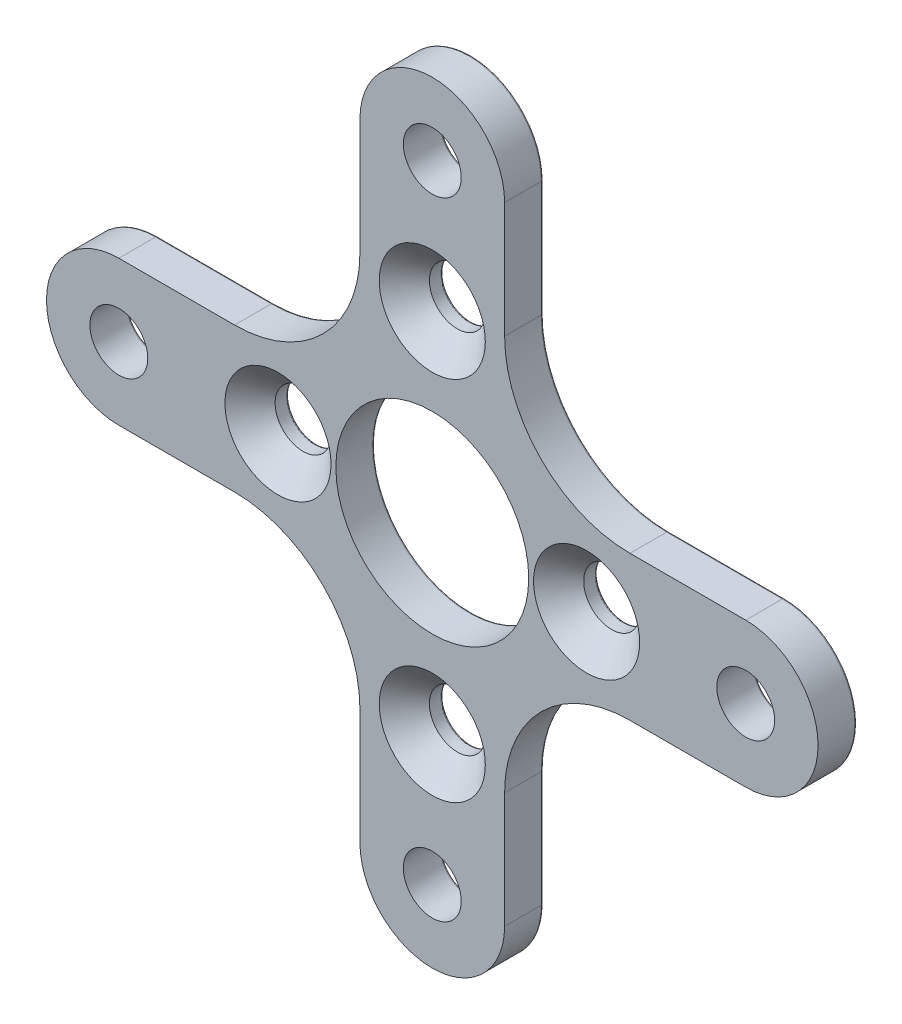
from build123d import *

# Parameters (mm, degrees)
ESQUISSE1_R                                  = 5
ESQUISSE1_R_2                                = 1.5
BOSS_EXTRU_1_DEPTH                           = 1
FRAISAGE_POUR_VIS_T_TE_FRAIS_E_M2_51_A_COUNT = 2
FRAISAGE_POUR_VIS_T_TE_FRAIS_E_M2_51_A_PITCH = 12.419742348
FRAISAGE_POUR_VIS_T_TE_FRAIS_E_M2_2_COUNT    = 2
FRAISAGE_POUR_VIS_T_TE_FRAIS_E_M2_2_PITCH    = 16
FRAISAGE_POUR_VIS_T_TE_FRAIS_E_M2_3_COUNT    = 2
FRAISAGE_POUR_VIS_T_TE_FRAIS_E_M2_3_PITCH    = 12.419742348
CONG_1_R                                     = 0.1


with BuildPart() as part:
    # Esquisse1 → Boss.-Extru.1 (new, symmetric)
    with BuildSketch(Plane.XY):
        with BuildLine():
            Line((-3.75, 16.25), (-3.75, 10.25))
            ThreePointArc((-3.75, 10.25), (-5.653805922, 5.653805922), (-10.25, 3.75))
            Line((-10.25, 3.75), (-16.25, 3.75))
            ThreePointArc((-16.25, 3.75), (-20, 0), (-16.25, -3.75))
            Line((-16.25, -3.75), (-10.25, -3.75))
            ThreePointArc((-10.25, -3.75), (-5.653805922, -5.653805922), (-3.75, -10.25))
            Line((-3.75, -10.25), (-3.75, -16.25))
            ThreePointArc((-3.75, -16.25), (0, -20), (3.75, -16.25))
            Line((3.75, -16.25), (3.75, -10.25))
            ThreePointArc((3.75, -10.25), (5.653805922, -5.653805922), (10.25, -3.75))
            Line((10.25, -3.75), (16.25, -3.75))
            ThreePointArc((16.25, -3.75), (20, 0), (16.25, 3.75))
            Line((16.25, 3.75), (10.25, 3.75))
            ThreePointArc((10.25, 3.75), (5.653805922, 5.653805922), (3.75, 10.25))
            Line((3.75, 10.25), (3.75, 16.25))
            ThreePointArc((3.75, 16.25), (0, 20), (-3.75, 16.25))
        make_face()
        Circle(ESQUISSE1_R, mode=Mode.SUBTRACT)
        with Locations((0, 16.25)):
            Circle(ESQUISSE1_R_2, mode=Mode.SUBTRACT)
        with Locations((16.25, 0)):
            Circle(ESQUISSE1_R_2, mode=Mode.SUBTRACT)
        with Locations((-16.25, 0)):
            Circle(ESQUISSE1_R_2, mode=Mode.SUBTRACT)
        with Locations((0, -16.25)):
            Circle(ESQUISSE1_R_2, mode=Mode.SUBTRACT)
    extrude(amount=BOSS_EXTRU_1_DEPTH, both=True)

    # Esquisse3 → Fraisage pour vis à tête fraisée M2.51 (revolve, cut)
    with BuildSketch(Plane(origin=(-8, 0, 1), x_dir=(0, -1, 0), z_dir=(1, 0, 0))):
        Polygon((0, 0), (0, 2), (1.45, 2), (1.45, 1.3), (2.75, 0), align=None)
    fraisage_pour_vis_t_te_frais_e_m2_51 = revolve(axis=Axis((-8, 0, 7.35), (0, 0, -1)), mode=Mode.SUBTRACT)

    # Fraisage pour vis à tête fraisée M2.51 a: Fraisage pour vis à tête fraisée M2.51 ×2
    with Locations(*[Vector(0.6441357457827798, 0.7649111981170509, 0) * (i * FRAISAGE_POUR_VIS_T_TE_FRAIS_E_M2_51_A_PITCH) for i in range(1, FRAISAGE_POUR_VIS_T_TE_FRAIS_E_M2_51_A_COUNT)]):
        add(fraisage_pour_vis_t_te_frais_e_m2_51, mode=Mode.SUBTRACT)

    # Fraisage pour vis _ t_te frais_e M2. 2: Fraisage pour vis à tête fraisée M2.51 ×2
    with Locations(*[(i * FRAISAGE_POUR_VIS_T_TE_FRAIS_E_M2_2_PITCH, 0, 0) for i in range(1, FRAISAGE_POUR_VIS_T_TE_FRAIS_E_M2_2_COUNT)]):
        add(fraisage_pour_vis_t_te_frais_e_m2_51, mode=Mode.SUBTRACT)

    # Fraisage pour vis _ t_te frais_e M2. 3: Fraisage pour vis à tête fraisée M2.51 ×2
    with Locations(*[Vector(0.6441357457827798, -0.7649111981170509, 0) * (i * FRAISAGE_POUR_VIS_T_TE_FRAIS_E_M2_3_PITCH) for i in range(1, FRAISAGE_POUR_VIS_T_TE_FRAIS_E_M2_3_COUNT)]):
        add(fraisage_pour_vis_t_te_frais_e_m2_51, mode=Mode.SUBTRACT)

    # Congé1
    cong_1_edges = [part.edges().sort_by_distance(p)[0] for p in [
        (3.75, 13.25, -1),
        (5.653805922, 5.653805922, -1),
        (13.25, 3.75, -1),
        (20, 0, -1),
        (13.25, -3.75, -1),
        (5.653805922, -5.653805922, -1),
        (3.75, -13.25, -1),
        (0, -20, -1),
        (-3.75, -13.25, -1),
        (-5.653805922, -5.653805922, -1),
        (-13.25, -3.75, -1),
        (-20, 0, -1),
        (-13.25, 3.75, -1),
        (-5.653805922, 5.653805922, -1),
        (-3.75, 13.25, -1),
        (0, 20, -1),
        (-5, 0, -1),
        (-17.75, 0, -1),
        (-1.5, 16.25, -1),
        (14.75, 0, -1),
        (-1.5, -16.25, -1),
        (0, -8.05, -1),
        (8, 1.45, -1),
        (0, 10.95, -1),
        (-8, 1.45, -1),
    ]]
    fillet(cong_1_edges, radius=CONG_1_R)


solid = part.part
